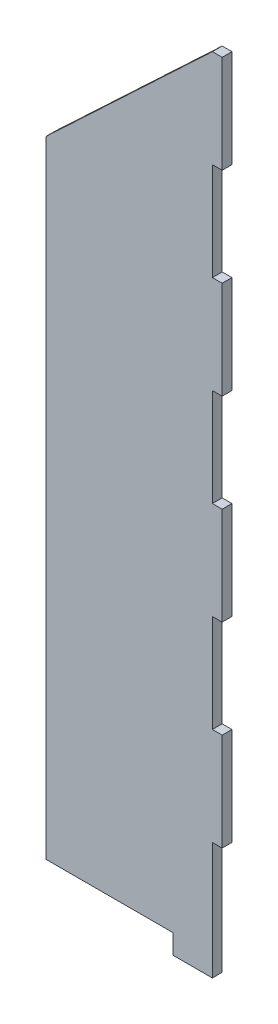
from build123d import *

# Parameters (mm, degrees)
BOSS_EXTRUDE1_DEPTH = 3.175


with BuildPart() as part:
    # Sketch1 → Boss-Extrude1 (new body)
    with BuildSketch(Plane.XY):
        Polygon((-26.9875, -101.6), (14.2875, -101.6), (14.2875, -107.95), (26.9875, -107.95), (26.9875, -69.85), (30.1625, -69.85), (30.1625, -38.1), (26.9875, -38.1), (26.9875, -6.35), (30.1625, -6.35), (30.1625, 25.4), (26.9875, 25.4), (26.9875, 57.15), (30.1625, 57.15), (30.1625, 88.9), (26.9875, 88.9), (26.9875, 120.65), (30.1625, 120.65), (30.1625, 152.4), (26.9875, 152.4), (-26.9875, 101.6), align=None)
    extrude(amount=BOSS_EXTRUDE1_DEPTH)


solid = part.part
